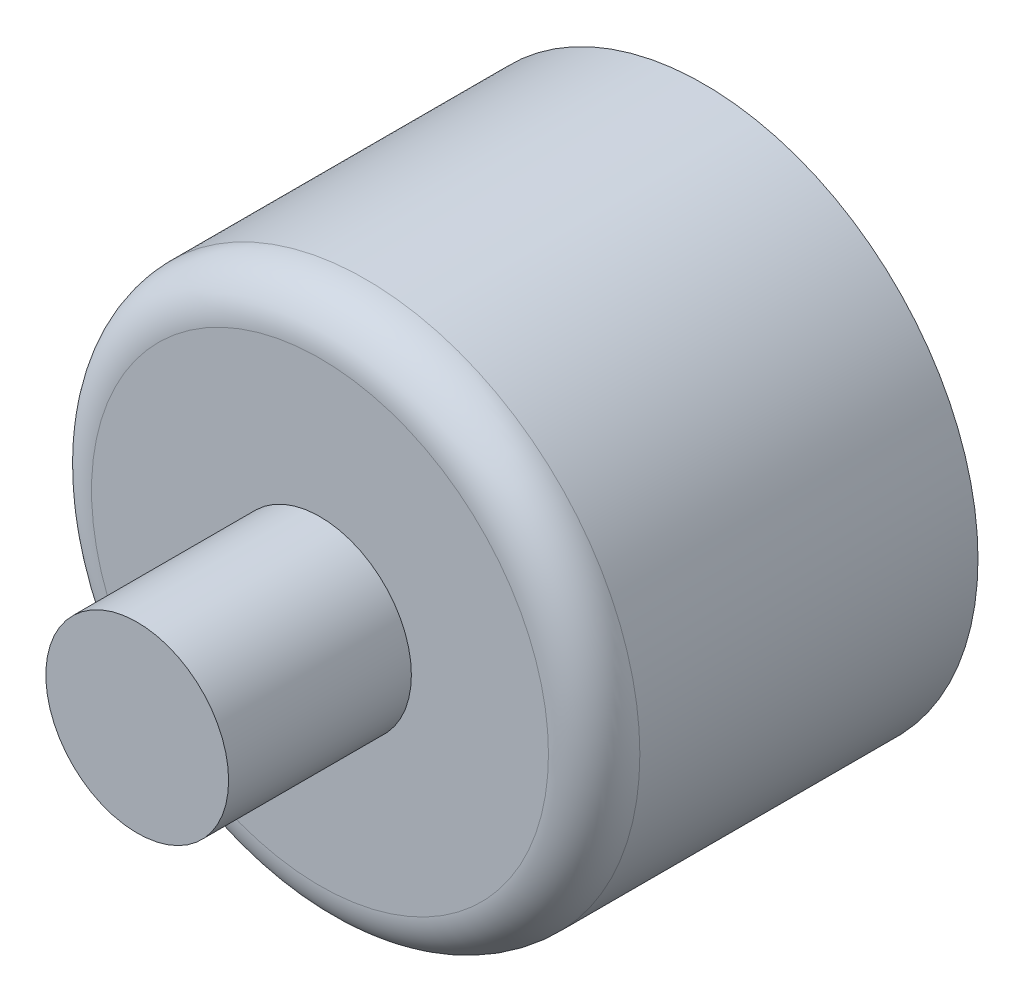
from build123d import *

# Parameters (mm, degrees)
SKETCH1_R           = 30
BOSS_EXTRUDE1_DEPTH = 42
SKETCH3_R           = 10
BOSS_EXTRUDE2_DEPTH = 20
FILLET1_R           = 5
BOSS_EXTRUDE6_DEPTH = 2


with BuildPart() as part:
    # Sketch1 → Boss-Extrude1 (new body)
    with BuildSketch(Plane.XY):
        Circle(SKETCH1_R)
    extrude(amount=BOSS_EXTRUDE1_DEPTH)

    # Sketch3 → Boss-Extrude2 (add)
    with BuildSketch(Plane.XY.offset(42)):
        Circle(SKETCH3_R)
    extrude(amount=BOSS_EXTRUDE2_DEPTH)

    # Fillet1
    fillet1_edges = [part.edges().sort_by_distance(p)[0] for p in [
        (-30, 0, 42),
    ]]
    fillet(fillet1_edges, radius=FILLET1_R)


with BuildPart() as body_2:
    # Sketch9 → Boss-Extrude6 (new body)
    with BuildSketch(Plane(origin=(0, -30, 0), x_dir=(1, 0, 0), z_dir=(0, 1, 0))):
        with BuildLine():
            Line((-2.641982759, -19.140114943), (2.641982759, -19.140114943))
            ThreePointArc((2.641982759, -19.140114943), (4.217902299, -20.716034483), (2.641982759, -22.291954023))
            Line((2.641982759, -22.291954023), (-2.641982759, -22.291954023))
            ThreePointArc((-2.641982759, -22.291954023), (-4.217902299, -20.716034483), (-2.641982759, -19.140114943))
        make_face()
    extrude(amount=-BOSS_EXTRUDE6_DEPTH)


solid = Compound([part.part, body_2.part])
